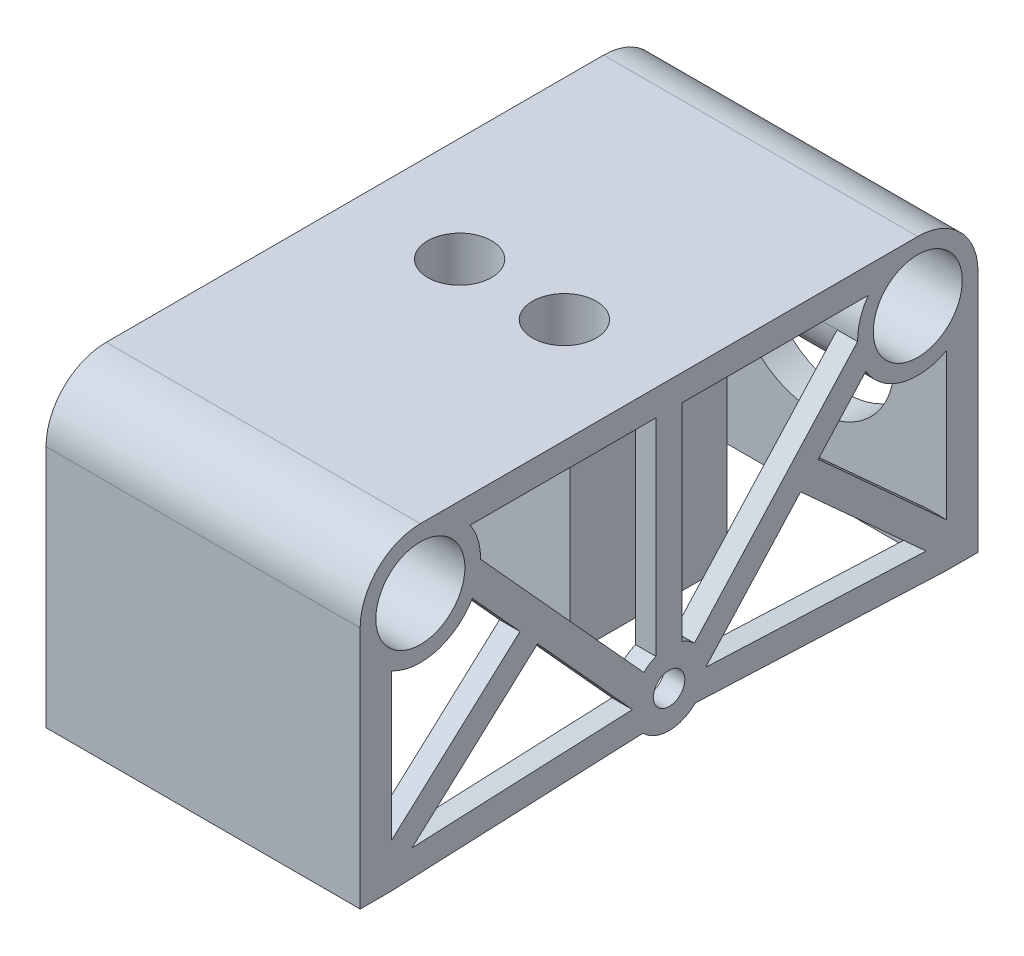
from build123d import *

# Parameters (mm, degrees)
SKETCH4_W           = 60
SKETCH4_H           = 58
BOSS_EXTRUDE2_DEPTH = 59
SKETCH6_R           = 8.500009
SKETCH6_R_2         = 3
SKETCH6_R_3         = 8.5
CUT_EXTRUDE2_DEPTH  = 90.005618
BOSS_EXTRUDE3_START = -30
BOSS_EXTRUDE3_DEPTH = 26.1
CUT_EXTRUDE7_DEPTH  = 52.2
SKETCH9_R           = 6.1
CUT_EXTRUDE8_DEPTH  = 89.005682
SKETCH10_R          = 15.29021
CUT_EXTRUDE9_DEPTH  = 10


with BuildPart() as part:
    # Sketch4 → Boss-Extrude2 (new, symmetric)
    with BuildSketch(Plane.XY):
        Rectangle(SKETCH4_W, SKETCH4_H)
    extrude(amount=BOSS_EXTRUDE2_DEPTH, both=True)

    # Sketch6 → Cut-Extrude2 (cut, through all)
    with BuildSketch(Plane.ZY.offset(30)):
        with BuildLine():
            ThreePointArc((-38.013169, 24), (-36.495651, 20.839801), (-36.000743, 17.369241))
            Line((-36.000743, 17.369241), (-4.839233, -16.942149))
            ThreePointArc((-4.839233, -16.942149), (-3.743539, -16.08511), (-2.500009, -15.461657))
            Line((-2.500009, -15.461657), (-2.500009, 24))
            Line((-2.500009, 24), (-38.013169, 24))
        make_face()
        with BuildLine():
            Line((-28.479809, 1.651024), (-37.584065, 11.67556))
            ThreePointArc((-37.584065, 11.67556), (-44.426868, 6.418217), (-53.000009, 7.40049))
            Line((-53.000009, 7.40049), (-53.000009, -20.618154))
            Line((-53.000009, -20.618154), (-28.479809, 1.651024))
        make_face()
        Polygon((-7.000009, -22.000005), (-25.118256, -2.050322), (-49.094983, -23.825919), align=None)
        with BuildLine():
            ThreePointArc((4.9821, -26.917179), (-9e-06, -29.000005), (-4.982118, -26.917179))
            Line((-4.982118, -26.917179), (-53.000009, -29.000005))
            Line((-53.000009, -29.000005), (-53.000009, -39.703251))
            Line((-53.000009, -39.703251), (52.999991, -37.936887))
            Line((52.999991, -37.936887), (52.999991, -29.000005))
            Line((52.999991, -29.000005), (4.9821, -26.917179))
        make_face()
        with BuildLine():
            ThreePointArc((37.027265, 22.251018), (37.481967, 23.147065), (38.013151, 24))
            Line((38.013151, 24), (2.499991, 24))
            Line((2.499991, 24), (2.499991, -15.461657))
            ThreePointArc((2.499991, -15.461657), (3.743521, -16.08511), (4.839215, -16.942149))
            Line((4.839215, -16.942149), (36.000725, 17.369241))
            ThreePointArc((36.000725, 17.369241), (36.246101, 19.866462), (37.027265, 22.251018))
        make_face()
        Polygon((6.999991, -22.000005), (49.094964, -23.825919), (25.118238, -2.050322), align=None)
        with BuildLine():
            Line((37.584046, 11.67556), (28.479791, 1.651024))
            Line((28.479791, 1.651024), (52.999991, -20.618154))
            Line((52.999991, -20.618154), (52.999991, 7.40049))
            ThreePointArc((52.999991, 7.40049), (52.30182, 7.050477), (51.581504, 6.748658))
            ThreePointArc((51.581504, 6.748658), (43.681779, 6.652356), (37.584046, 11.67556))
        make_face()
        with BuildLine():
            ThreePointArc((-59.000009, 17.5), (-55.631734, 25.631734), (-47.5, 29.000009))
            Line((-47.5, 29.000009), (-47.5, 35.726664))
            Line((-47.5, 35.726664), (-66.854255, 35.726664))
            Line((-66.854255, 35.726664), (-66.147279, 17.5))
            Line((-66.147279, 17.5), (-59.000009, 17.5))
        make_face()
        with BuildLine():
            Line((47.076133, 34.936715), (47.499986, 29))
            ThreePointArc((47.499986, 29), (55.631716, 25.631727), (58.999989, 17.499996))
            Line((58.999989, 17.499996), (67.171398, 17.499996))
            Line((67.171398, 17.499996), (67.171398, 34.57466))
            Line((67.171398, 34.57466), (47.076133, 34.936715))
        make_face()
        with Locations((-47.5, 17.5)):
            Circle(SKETCH6_R)
        with Locations((-9e-06, -22.000005)):
            Circle(SKETCH6_R_2)
        with Locations((47.499991, 17.499994)):
            Circle(SKETCH6_R_3)
    extrude(amount=-CUT_EXTRUDE2_DEPTH, mode=Mode.SUBTRACT)

    # Sketch7 → Boss-Extrude3 (add, symmetric)
    with BuildSketch(Plane.ZY.offset(30).offset(BOSS_EXTRUDE3_START)):
        Polygon((-15, 24), (-15, -11), (15.389045, -11), (15, 24), align=None)
    extrude(amount=BOSS_EXTRUDE3_DEPTH, both=True)

    # Sketch8 → Cut-Extrude7 (cut)
    with BuildSketch(Plane.ZY.offset(26.1)):
        with BuildLine():
            Line((-15, 24), (-38.013169, 24))
            ThreePointArc((-38.013169, 24), (-38.964218, 9.793476), (-53.000009, 7.40049))
            Line((-53.000009, 7.40049), (-53.000009, -24.011121))
            Line((-53.000009, -24.011121), (-53.000009, -39.458207))
            Line((-53.000009, -39.458207), (52.999999, -37.612059))
            Line((52.999999, -37.612059), (52.999999, -24.011121))
            Line((52.999999, -24.011121), (52.999999, 7.40049))
            ThreePointArc((52.999999, 7.40049), (38.964206, 9.793474), (38.013158, 24))
            Line((38.013158, 24), (14.99999, 24))
            Line((14.99999, 24), (14.99999, -11))
            Line((14.99999, -11), (-14.201079, -11))
            Line((-14.201079, -11), (-15, -11))
            Line((-15, -11), (-15, 24))
        make_face()
    extrude(amount=-CUT_EXTRUDE7_DEPTH, mode=Mode.SUBTRACT)

    # Sketch9 → Cut-Extrude8 (cut, through all)
    with BuildSketch(Plane(origin=(0, 29, 0), x_dir=(1, 0, 0), z_dir=(0, 1, 0))):
        with Locations(Location((-10, 2e-06, 0), (0, 0, 270))):
            Circle(SKETCH9_R)
        with Locations(Location((10, 2e-06, 0), (0, 0, 90))):
            Circle(SKETCH9_R)
    extrude(amount=-CUT_EXTRUDE8_DEPTH, mode=Mode.SUBTRACT)

    # Sketch10 → Cut-Extrude9 (cut)
    with BuildSketch(Plane(origin=(0, 0, -59), x_dir=(-1, 0, 0), z_dir=(0, 0, -1))):
        with Locations((-4.718192, 0)):
            Circle(SKETCH10_R)
    extrude(amount=-CUT_EXTRUDE9_DEPTH, mode=Mode.SUBTRACT)


solid = part.part
